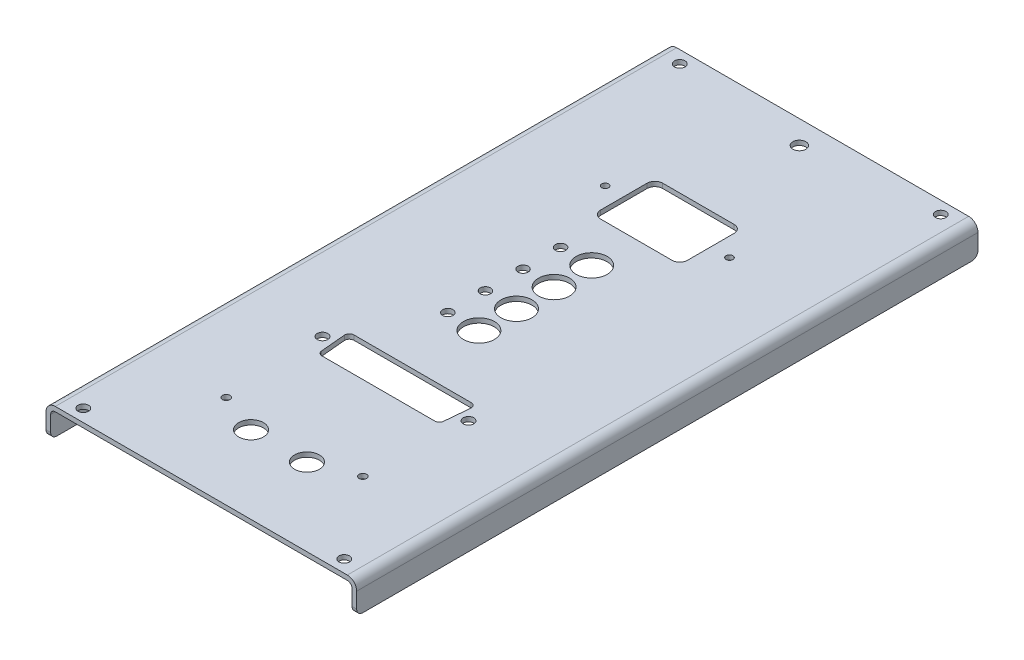
from build123d import *

# Parameters (mm, degrees)
EXTRUDE_1_DEPTH     = 200
SKETCH_2_R          = 1.7
CUT_EXTRUDE_1_DEPTH = 10
FILLET_1_R          = 2
SKETCH_5_R          = 1.7
SKETCH_5_R_2        = 1.2
SKETCH_5_R_3        = 4
CUT_EXTRUDE_2_DEPTH = 10
SKETCH_7_R          = 1.1
SKETCH_7_R_2        = 2.1
CUT_EXTRUDE_3_DEPTH = 10
SKETCH_11_R         = 5
SKETCH_11_R_2       = 1.65
CUT_EXTRUDE_4_DEPTH = 10
SKETCH_12_R         = 1.6
CUT_EXTRUDE_5_DEPTH = 10


with BuildPart() as part:
    # Эскиз1 → Вытянуть1 (new body)
    with BuildSketch(Plane.XY):
        with BuildLine():
            Line((-47, 0), (47, 0))
            ThreePointArc((47, 0), (49.121320344, -0.878679656), (50, -3))
            Line((50, -3), (50, -10))
            Line((50, -10), (48.5, -10))
            Line((48.5, -10), (48.5, -3))
            ThreePointArc((48.5, -3), (48.060660172, -1.939339828), (47, -1.5))
            Line((47, -1.5), (-47, -1.5))
            ThreePointArc((-47, -1.5), (-48.060660172, -1.939339828), (-48.5, -3))
            Line((-48.5, -3), (-48.5, -10))
            Line((-48.5, -10), (-50, -10))
            Line((-50, -10), (-50, -3))
            ThreePointArc((-50, -3), (-49.121320344, -0.878679656), (-47, 0))
        make_face()
    extrude(amount=EXTRUDE_1_DEPTH)

    # Эскиз2 → Вырез-Вытянуть1 (cut)
    with BuildSketch(Plane(origin=(0, 0, 0), x_dir=(1, 0, 0), z_dir=(0, 1, 0))):
        with Locations(Location((-42, -4, 0), (0, 0, 180))):
            Circle(SKETCH_2_R)
        with Locations(Location((42, -4, 0), (0, 0, 180))):
            Circle(SKETCH_2_R)
        with Locations(Location((42, -196, 0), (0, 0, 270))):
            Circle(SKETCH_2_R)
        with Locations(Location((-42, -196, 0), (0, 0, 270))):
            Circle(SKETCH_2_R)
    extrude(amount=-CUT_EXTRUDE_1_DEPTH, mode=Mode.SUBTRACT)

    # Скругление1
    fillet_1_edges = [part.edges().sort_by_distance(p)[0] for p in [
        (-49.25, -10, 200),
        (49.25, -10, 0),
        (-49.25, -10, 0),
        (49.25, -10, 200),
    ]]
    fillet(fillet_1_edges, radius=FILLET_1_R)

    # Эскиз5 → Вырез-Вытянуть2 (cut)
    with BuildSketch(Plane(origin=(0, 0, 0), x_dir=(-1, 0, 0), z_dir=(0, 1, 0))):
        with Locations((-23.5, 137.5)):
            Circle(SKETCH_5_R)
        with Locations((23.5, 137.5)):
            Circle(SKETCH_5_R)
        with Locations((-22, 170)):
            Circle(SKETCH_5_R_2)
        with Locations((22, 170)):
            Circle(SKETCH_5_R_2)
        with Locations((-9, 175)):
            Circle(SKETCH_5_R_3)
        with Locations((9, 175)):
            Circle(SKETCH_5_R_3)
        with BuildLine():
            Line((-20.35129058, 133.635803619), (-19.624017853, 141.635803619))
            ThreePointArc((-19.624017853, 141.635803619), (-19.141685475, 142.607633836), (-18.130178043, 143))
            Line((-18.130178043, 143), (18.130178043, 143))
            ThreePointArc((18.130178043, 143), (19.141685475, 142.607633836), (19.624017853, 141.635803619))
            Line((19.624017853, 141.635803619), (20.35129058, 133.635803619))
            ThreePointArc((20.35129058, 133.635803619), (19.965084606, 132.488492568), (18.85745077, 132))
            Line((18.85745077, 132), (-18.85745077, 132))
            ThreePointArc((-18.85745077, 132), (-19.965084606, 132.488492568), (-20.35129058, 133.635803619))
        make_face()
    extrude(amount=-CUT_EXTRUDE_2_DEPTH, mode=Mode.SUBTRACT)

    # Эскиз7 → Вырез-Вытянуть3 (cut)
    with BuildSketch(Plane(origin=(0, 0, 0), x_dir=(-1, 0, 0), z_dir=(0, 1, 0))):
        with Locations(Location((20, 50, 0), (0, 0, 90))):
            Circle(SKETCH_7_R)
        with Locations(Location((-20, 50, 0), (0, 0, 90))):
            Circle(SKETCH_7_R)
        with Locations((0, 7.5)):
            Circle(SKETCH_7_R_2)
        with BuildLine():
            Line((-11.5, 40), (11.5, 40))
            ThreePointArc((11.5, 40), (13.267766953, 40.732233047), (14, 42.5))
            Line((14, 42.5), (14, 57.5))
            ThreePointArc((14, 57.5), (13.267766953, 59.267766953), (11.5, 60))
            Line((11.5, 60), (-11.5, 60))
            ThreePointArc((-11.5, 60), (-13.267766953, 59.267766953), (-14, 57.5))
            Line((-14, 57.5), (-14, 42.5))
            ThreePointArc((-14, 42.5), (-13.267766953, 40.732233047), (-11.5, 40))
        make_face()
    extrude(amount=-CUT_EXTRUDE_3_DEPTH, mode=Mode.SUBTRACT)

    # Эскиз11 → Вырез-Вытянуть4 (cut)
    with BuildSketch(Plane(origin=(0, 0, 0), x_dir=(-1, 0, 0), z_dir=(0, 1, 0))):
        with Locations((0, 98.55)):
            Circle(SKETCH_11_R)
        with Locations((0, 86.45)):
            Circle(SKETCH_11_R)
        with Locations((0, 74.35)):
            Circle(SKETCH_11_R)
        with Locations((0, 110.65)):
            Circle(SKETCH_11_R)
        with Locations((10, 98.55)):
            Circle(SKETCH_11_R_2)
        with Locations((10, 74.35)):
            Circle(SKETCH_11_R_2)
        with Locations((10, 86.45)):
            Circle(SKETCH_11_R_2)
        with Locations(Location((10, 110.65, 0), (0, 0, 90))):
            Circle(SKETCH_11_R_2)
    extrude(amount=-CUT_EXTRUDE_4_DEPTH, mode=Mode.SUBTRACT)

    # Эскиз12 → Вырез-Вытянуть5 (cut)
    with BuildSketch(Plane.ZY.offset(50)):
        with Locations((100, -6.5)):
            Circle(SKETCH_12_R)
    extrude(amount=-CUT_EXTRUDE_5_DEPTH, mode=Mode.SUBTRACT)


solid = part.part
